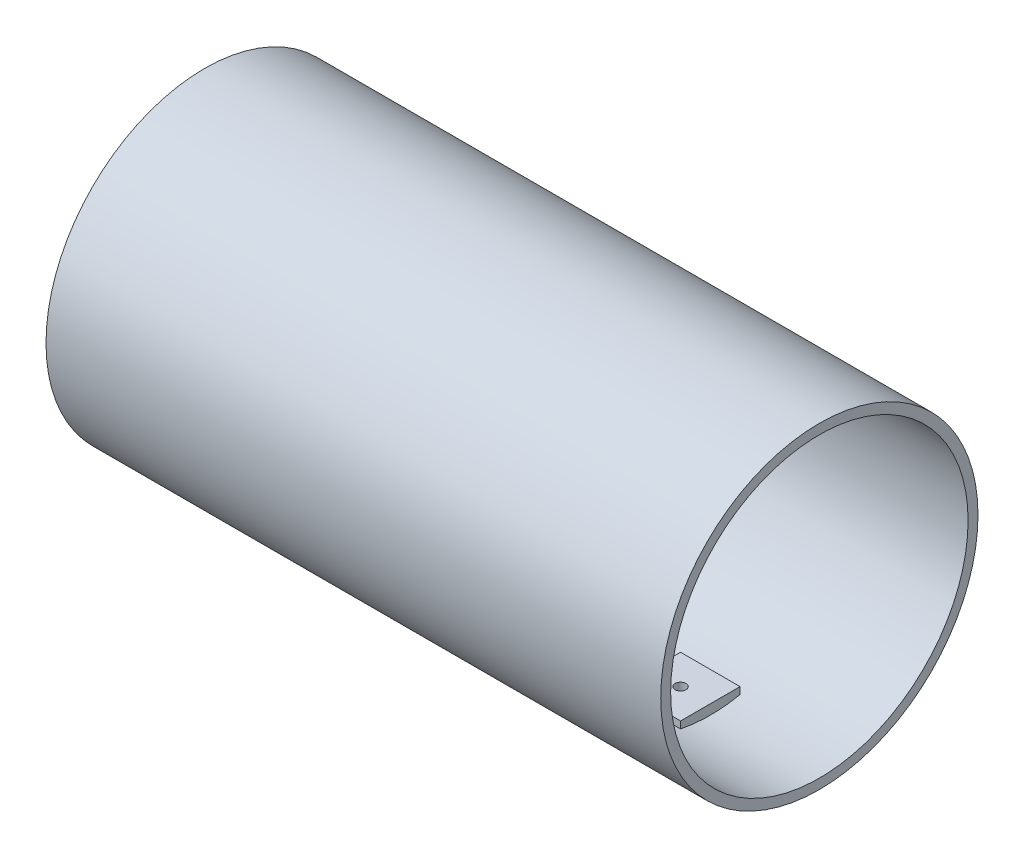
from build123d import *

# Parameters (mm, degrees)
SKIZZE1_W                            = 310
SKIZZE1_H                            = 5
AUFSATZ_LINEAR_AUSTRAGEN1_DEPTH      = 2.5
AUFSATZ_LINEAR_AUSTRAGEN1_DEPTH_BACK = 2.5
SKIZZE5_W                            = 30
SKIZZE5_H                            = 30
AUFSATZ_LINEAR_AUSTRAGEN2_DEPTH      = 5
DURCHGANGSLOCH_F_R_M51_D             = 5.5
DURCHGANGSLOCH_F_R_M51_DEPTH         = 10


with BuildPart() as part:
    # Skizze1 → Rotation1 (revolve)
    with BuildSketch(Plane.XY, mode=Mode.PRIVATE) as rotation1_sk:
        with Locations((155, 77.5)):
            Rectangle(SKIZZE1_W, SKIZZE1_H)
    revolve(rotation1_sk.sketch.rotate(Axis((0, 0, 0), (1, 0, 0)), 90), axis=Axis((0, 0, 0), (1, 0, 0)))

    # Skizze3 → Aufsatz-Linear austragen1 (add, two sides: drawn at the far end of the back side and taken through both)
    with BuildSketch(Plane(origin=(0, 0, 0), x_dir=(1, 0, 0), z_dir=(0, 1, 0)).offset(-AUFSATZ_LINEAR_AUSTRAGEN1_DEPTH_BACK)):
        Polygon((255, -55), (275, -55), (275, -45), (195, -45), (195, -55), (215, -55), (215, -75), (255, -75), align=None)
    extrude(amount=AUFSATZ_LINEAR_AUSTRAGEN1_DEPTH + AUFSATZ_LINEAR_AUSTRAGEN1_DEPTH_BACK)

    # Skizze5 → Aufsatz-Linear austragen2 (add)
    with BuildSketch(Plane(origin=(0, -75, 0), x_dir=(1, 0, 0), z_dir=(0, 1, 0))):
        with Locations((70, 0)):
            Rectangle(SKIZZE5_W, SKIZZE5_H)
    aufsatz_linear_austragen2 = extrude(amount=AUFSATZ_LINEAR_AUSTRAGEN2_DEPTH)

    # Durchgangsloch für M51
    with Locations(Plane(origin=(0, -70, 0), x_dir=(1, 0, 0), z_dir=(0, 1, 0))):
        with Locations((70, 0)):
            durchgangsloch_f_r_m51 = Hole(DURCHGANGSLOCH_F_R_M51_D / 2, depth=DURCHGANGSLOCH_F_R_M51_DEPTH)

    # Spiegeln2: Aufsatz-Linear austragen2, Durchgangsloch für M51 across plane
    add(aufsatz_linear_austragen2.mirror(Plane.ZY.offset(-155)))
    add(durchgangsloch_f_r_m51.mirror(Plane.ZY.offset(-155)), mode=Mode.SUBTRACT)


solid = part.part
